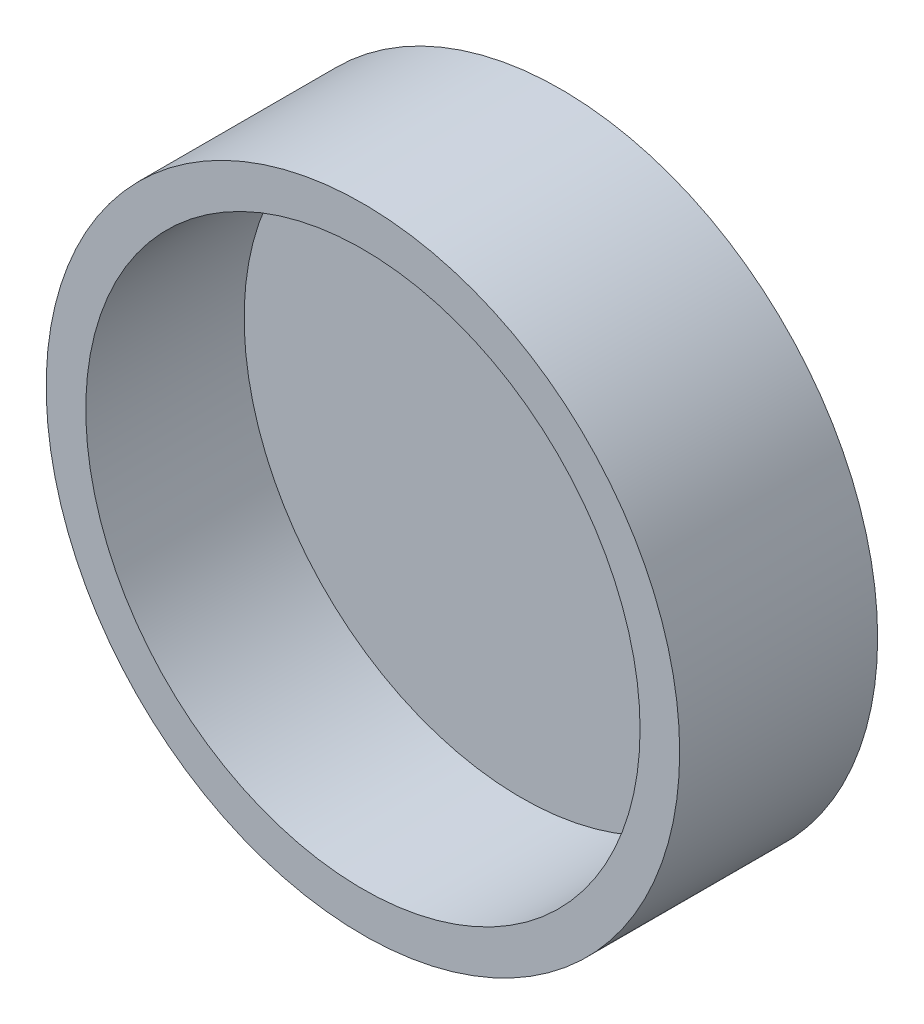
from build123d import *

# Parameters (mm, degrees)
SKETCH1_R           = 35
BOSS_EXTRUDE1_DEPTH = 20
SHELL1_T            = 5


with BuildPart() as part:
    # Sketch1 → Boss-Extrude1 (new body)
    with BuildSketch(Plane.XY):
        Circle(SKETCH1_R)
    extrude(amount=BOSS_EXTRUDE1_DEPTH)

    # Shell1
    shell1_openings = [part.faces().sort_by_distance(p)[0] for p in [
        (0, 0, 20),
    ]]
    offset(amount=SHELL1_T, openings=shell1_openings, kind=Kind.INTERSECTION)


solid = part.part
